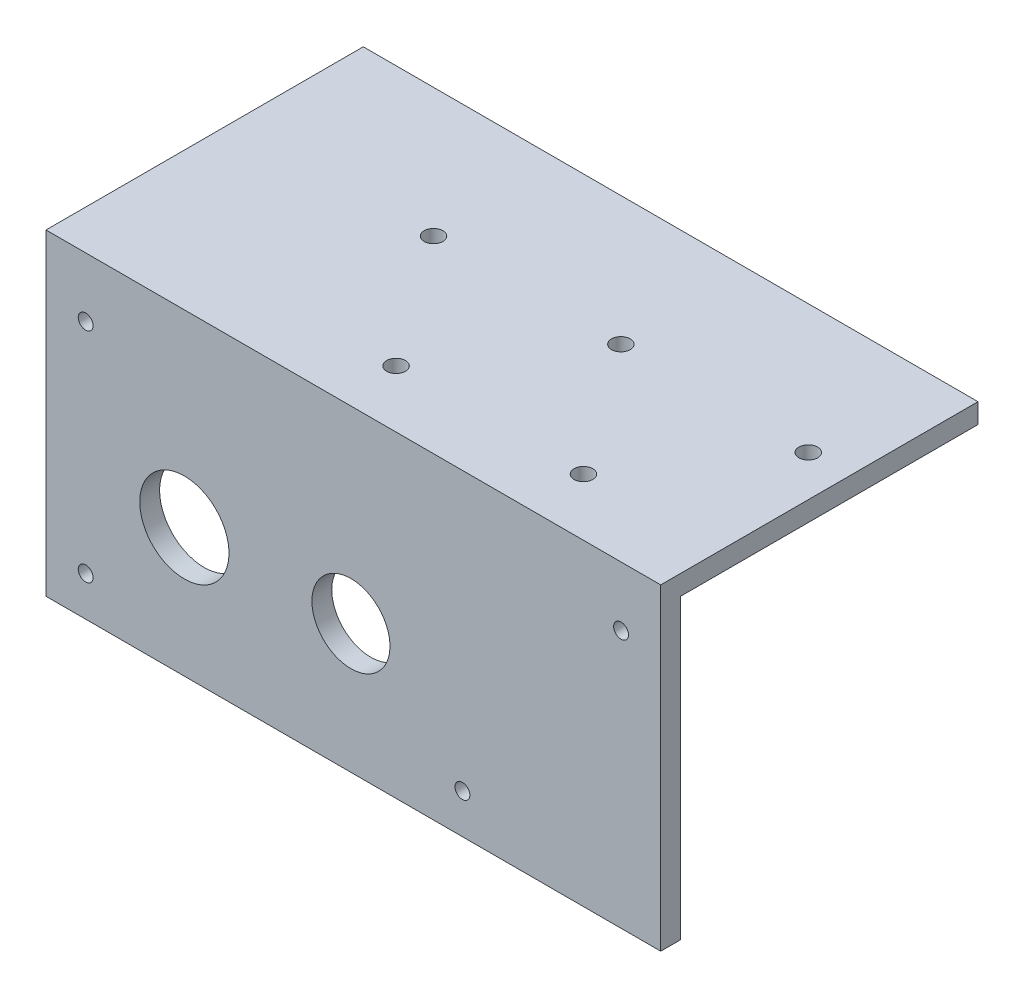
from build123d import *

# Parameters (mm, degrees)
SKETCH1_W           = 196.85
SKETCH1_H           = 101.6
SKETCH1_R           = 2.999999969
BOSS_EXTRUDE1_DEPTH = 6.35
SKETCH2_W           = 196.85
SKETCH2_H           = 6.35
BOSS_EXTRUDE2_DEPTH = 95.25
SKETCH4_R           = 12.500000019
SKETCH4_R_2         = 2.38125
SKETCH4_R_3         = 14.2875
CUT_EXTRUDE1_DEPTH  = 183.917715111


with BuildPart() as part:
    # Sketch1 → Boss-Extrude1 (new body)
    with BuildSketch(Plane(origin=(0, 0, 0), x_dir=(1, 0, 0), z_dir=(0, 1, 0))):
        with Locations((-25.3238, -1.549999948)):
            Rectangle(SKETCH1_W, SKETCH1_H)
        with Locations((-59.999999888, 8.000000002)):
            Circle(SKETCH1_R, mode=Mode.SUBTRACT)
        with Locations((0, 8.000000002)):
            Circle(SKETCH1_R, mode=Mode.SUBTRACT)
        with Locations((59.999999888, 8.000000002)):
            Circle(SKETCH1_R, mode=Mode.SUBTRACT)
        with Locations((29.999999944, -34.000000072)):
            Circle(SKETCH1_R, mode=Mode.SUBTRACT)
        with Locations((-29.999999944, -34.000000072)):
            Circle(SKETCH1_R, mode=Mode.SUBTRACT)
    extrude(amount=BOSS_EXTRUDE1_DEPTH)

    # Sketch2 → Boss-Extrude2 (add)
    with BuildSketch(Plane.XZ):
        with Locations((-25.3238, 49.174999948)):
            Rectangle(SKETCH2_W, SKETCH2_H)
    extrude(amount=BOSS_EXTRUDE2_DEPTH)

    # Sketch4 → Cut-Extrude1 (cut, through all)
    with BuildSketch(Plane(origin=(0, 0, 45.999999948), x_dir=(-1, 0, 0), z_dir=(0, 0, -1))):
        with Locations((26.098799974, -53.99999995)):
            Circle(SKETCH4_R)
        with Locations((-60.4012, -12.7)):
            Circle(SKETCH4_R_2)
        with Locations((111.0488, -12.7)):
            Circle(SKETCH4_R_2)
        with Locations((111.0488, -82.55)):
            Circle(SKETCH4_R_2)
        with Locations((-9.6012, -82.55)):
            Circle(SKETCH4_R_2)
        with Locations((79.438799974, -53.99999995)):
            Circle(SKETCH4_R_3)
    extrude(amount=-CUT_EXTRUDE1_DEPTH, mode=Mode.SUBTRACT)


solid = part.part
